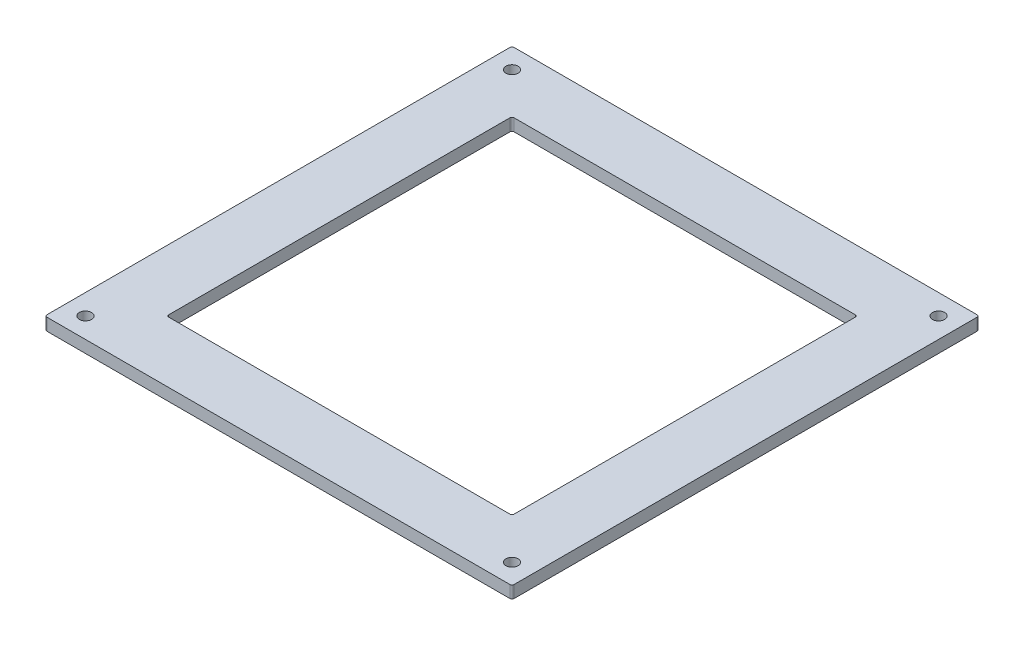
from build123d import *

# Parameters (mm, degrees)
SKETCH1_W          = 230
SKETCH1_H          = 230
SKETCH1_W_2        = 170
SKETCH1_H_2        = 170
BORDER_DEPTH       = 6
SKETCH2_R          = 3
CUT_EXTRUDE1_DEPTH = 326.324453431
FILLET1_R          = 1


with BuildPart() as part:
    # Sketch1 → border (new body)
    with BuildSketch(Plane(origin=(0, 0, 0), x_dir=(1, 0, 0), z_dir=(0, 1, 0))):
        with Locations((115, 115)):
            Rectangle(SKETCH1_W, SKETCH1_H)
        with Locations((115, 115)):
            Rectangle(SKETCH1_W_2, SKETCH1_H_2, mode=Mode.SUBTRACT)
    extrude(amount=BORDER_DEPTH)

    # Sketch2 → Cut-Extrude1 (cut, through all)
    with BuildSketch(Plane(origin=(0, 6, 0), x_dir=(1, 0, 0), z_dir=(0, 1, 0))):
        with Locations(Location((10, 220, 0), (0, 0, 270))):
            Circle(SKETCH2_R)
        with Locations(Location((220, 220, 0), (0, 0, 270))):
            Circle(SKETCH2_R)
        with Locations(Location((220, 10, 0), (0, 0, 270))):
            Circle(SKETCH2_R)
        with Locations(Location((10, 10, 0), (0, 0, 270))):
            Circle(SKETCH2_R)
    extrude(amount=-CUT_EXTRUDE1_DEPTH, mode=Mode.SUBTRACT)

    # Fillet1
    fillet1_edges = [part.edges().sort_by_distance(p)[0] for p in [
        (30, 3, -200),
        (30, 3, -30),
        (200, 3, -30),
        (200, 3, -200),
        (0, 3, -230),
        (230, 3, -230),
        (230, 3, 0),
        (0, 3, 0),
    ]]
    fillet(fillet1_edges, radius=FILLET1_R)


solid = part.part
